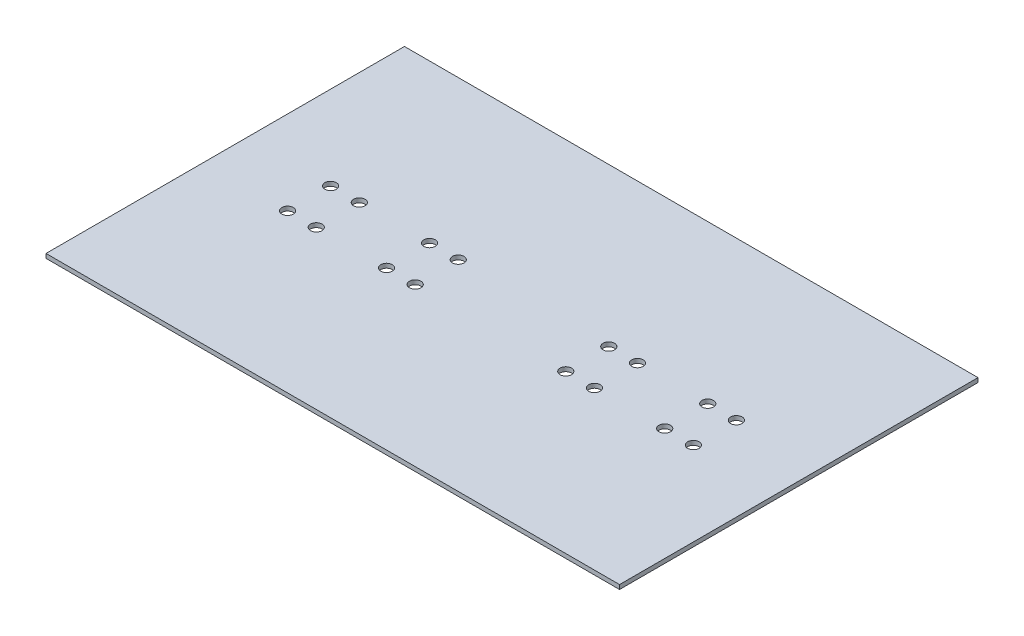
from build123d import *

# Parameters (mm, degrees)
SKETCH1_W           = 400
SKETCH1_H           = 250
BOSS_EXTRUDE1_DEPTH = 3
SKETCH2_R           = 4
CUT_EXTRUDE1_DEPTH  = 236.868607492


with BuildPart() as part:
    # Sketch1 → Boss-Extrude1 (new body)
    with BuildSketch(Plane(origin=(0, 0, 0), x_dir=(1, 0, 0), z_dir=(0, 1, 0))):
        Rectangle(SKETCH1_W, SKETCH1_H)
    extrude(amount=BOSS_EXTRUDE1_DEPTH)

    # Sketch2 → Cut-Extrude1 (cut, through all)
    with BuildSketch(Plane(origin=(0, 3, 0), x_dir=(1, 0, 0), z_dir=(0, 1, 0))):
        with Locations(Location((121.5, 15, 0), (0, 0, 270))):
            Circle(SKETCH2_R)
        with Locations(Location((141.5, 15, 0), (0, 0, 270))):
            Circle(SKETCH2_R)
        with Locations(Location((121.5, -15, 0), (0, 0, 270))):
            Circle(SKETCH2_R)
        with Locations(Location((141.5, -15, 0), (0, 0, 270))):
            Circle(SKETCH2_R)
        with Locations(Location((72.5, 15, 0), (0, 0, 270))):
            Circle(SKETCH2_R)
        with Locations(Location((52.5, 15, 0), (0, 0, 270))):
            Circle(SKETCH2_R)
        with Locations(Location((72.5, -15, 0), (0, 0, 270))):
            Circle(SKETCH2_R)
        with Locations(Location((52.5, -15, 0), (0, 0, 270))):
            Circle(SKETCH2_R)
        with Locations(Location((-52.5, -15, 0), (0, 0, 90))):
            Circle(SKETCH2_R)
        with Locations(Location((-72.5, -15, 0), (0, 0, 90))):
            Circle(SKETCH2_R)
        with Locations(Location((-52.5, 15, 0), (0, 0, 90))):
            Circle(SKETCH2_R)
        with Locations(Location((-72.5, 15, 0), (0, 0, 90))):
            Circle(SKETCH2_R)
        with Locations(Location((-141.5, -15, 0), (0, 0, 90))):
            Circle(SKETCH2_R)
        with Locations(Location((-121.5, -15, 0), (0, 0, 90))):
            Circle(SKETCH2_R)
        with Locations(Location((-141.5, 15, 0), (0, 0, 90))):
            Circle(SKETCH2_R)
        with Locations(Location((-121.5, 15, 0), (0, 0, 90))):
            Circle(SKETCH2_R)
    extrude(amount=-CUT_EXTRUDE1_DEPTH, mode=Mode.SUBTRACT)


solid = part.part
